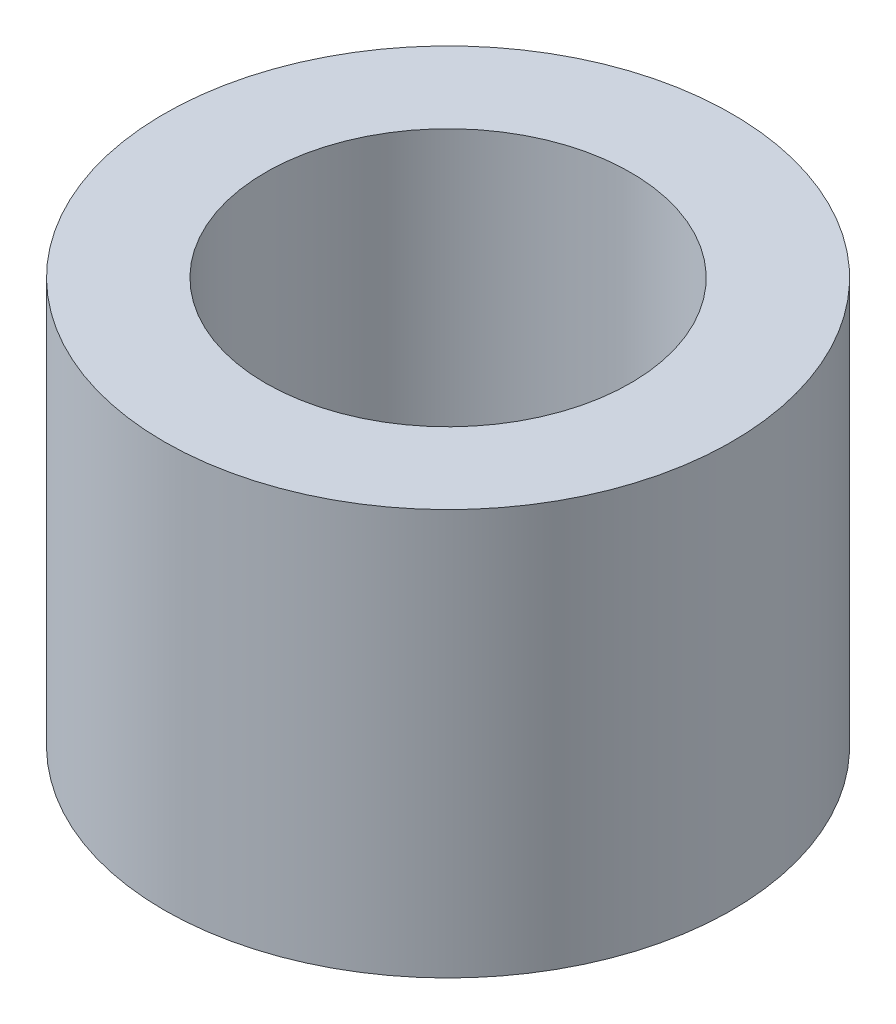
from build123d import *

# Parameters (mm, degrees)
SKETCH1_R           = 3.5
BOSS_EXTRUDE1_DEPTH = 5
SKETCH2_R           = 2.25
CUT_EXTRUDE1_DEPTH  = 8.03562364


with BuildPart() as part:
    # Sketch1 → Boss-Extrude1 (new body)
    with BuildSketch(Plane(origin=(0, 0, 0), x_dir=(1, 0, 0), z_dir=(0, 1, 0))):
        with Locations(Location((0, 0, 0), (0, 0, 270))):
            Circle(SKETCH1_R)
    extrude(amount=BOSS_EXTRUDE1_DEPTH)

    # Sketch2 → Cut-Extrude1 (cut, through all)
    with BuildSketch(Plane(origin=(0, 5, 0), x_dir=(1, 0, 0), z_dir=(0, 1, 0))):
        with Locations(Location((0, 0, 0), (0, 0, 270))):
            Circle(SKETCH2_R)
    extrude(amount=-CUT_EXTRUDE1_DEPTH, mode=Mode.SUBTRACT)


solid = part.part
